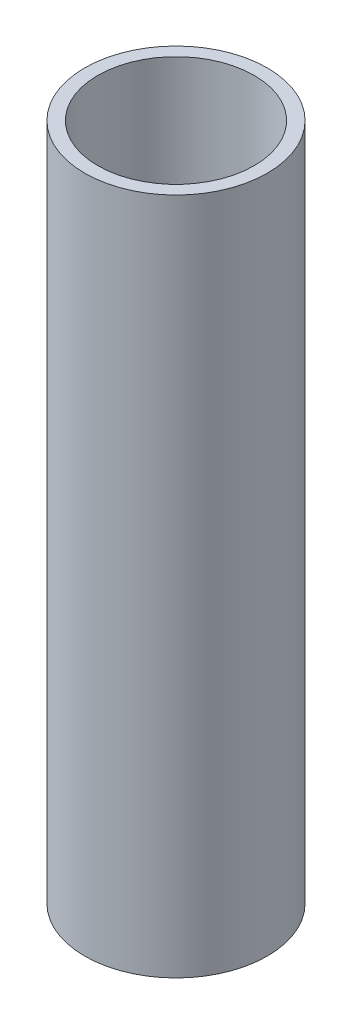
from build123d import *

# Parameters (mm, degrees)
SKETCH1_R           = 17.5
BOSS_EXTRUDE1_DEPTH = 130
SKETCH2_R           = 15
CUT_EXTRUDE1_DEPTH  = 133.334802679


with BuildPart() as part:
    # Sketch1 → Boss-Extrude1 (new body)
    with BuildSketch(Plane(origin=(0, 0, 0), x_dir=(1, 0, 0), z_dir=(0, 1, 0))):
        with Locations(Location((0, 0, 0), (0, 0, 270))):
            Circle(SKETCH1_R)
    extrude(amount=BOSS_EXTRUDE1_DEPTH)

    # Sketch2 → Cut-Extrude1 (cut, through all)
    with BuildSketch(Plane.XZ):
        with Locations(Location((0, 0, 0), (0, 0, 270))):
            Circle(SKETCH2_R)
    extrude(amount=-CUT_EXTRUDE1_DEPTH, mode=Mode.SUBTRACT)


solid = part.part
